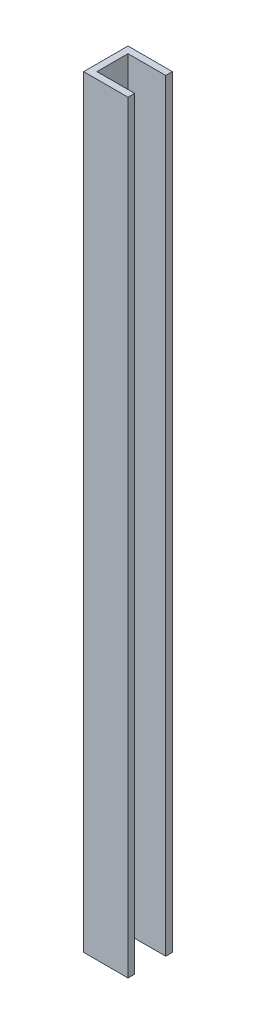
from build123d import *

# Parameters (mm, degrees)
BOSS_EXTRUDE1_DEPTH = 86


with BuildPart() as part:
    # Sketch2 → Boss-Extrude1 (new, symmetric)
    with BuildSketch(Plane(origin=(0, 0, 0), x_dir=(1, 0, 0), z_dir=(0, 1, 0))):
        Polygon((-5, 5), (-5, -5), (5, -5), (5, -3.5), (-3.5, -3.5), (-3.5, 3.5), (5, 3.5), (5, 5), align=None)
    extrude(amount=BOSS_EXTRUDE1_DEPTH, both=True)


solid = part.part
